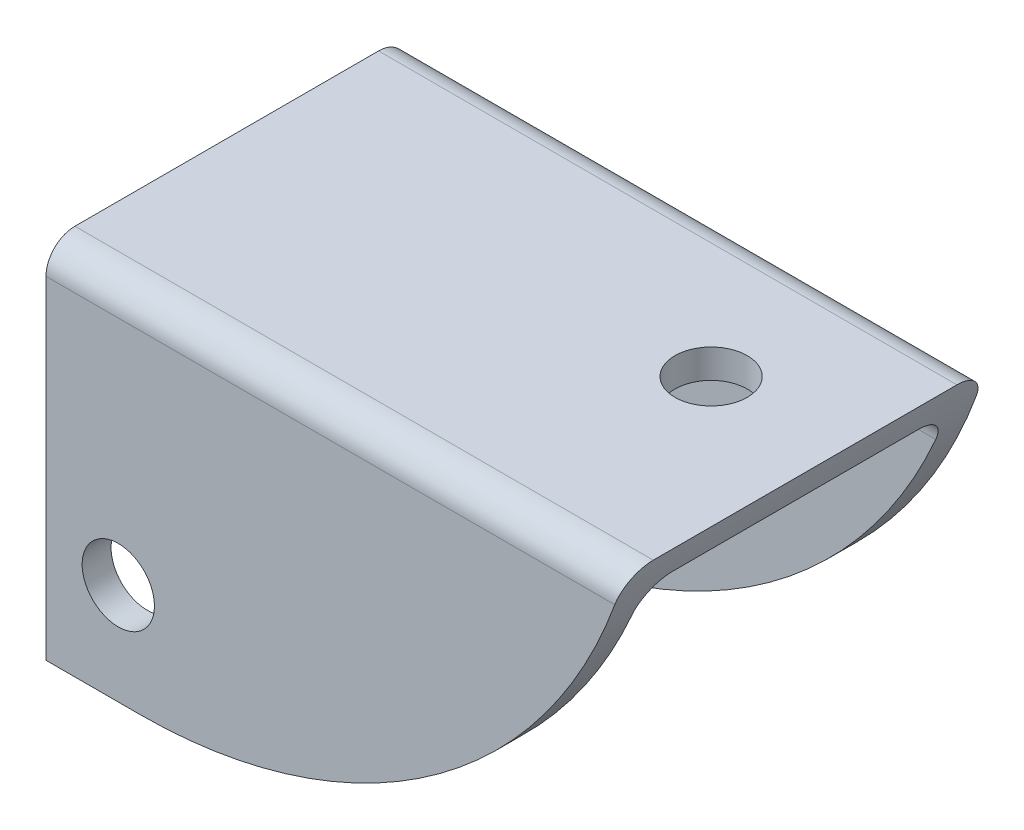
from build123d import *

# Parameters (mm, degrees)
EXTRUDE_1_DEPTH     = 40
CUT_EXTRUDE_1_DEPTH = 40
SKETCH_4_R          = 2.5
CUT_EXTRUDE_2_DEPTH = 54.38539126
SKETCH_5_R          = 2.5
CUT_EXTRUDE_3_DEPTH = 54.38539126
FILLET_1_R          = 2


with BuildPart() as part:
    # 草图1 → 凸台-拉伸1 (new body)
    with BuildSketch(Plane(origin=(0, 0, 0), x_dir=(0, 0, -1), z_dir=(1, 0, 0))):
        Polygon((0, 0), (0, 25), (25, 25), (25, 0), (23, 0), (23, 23), (2, 23), (2, 0), align=None)
    extrude(amount=EXTRUDE_1_DEPTH)

    # 草图3 → 切除-拉伸1 (cut)
    with BuildSketch(Plane.XY):
        with BuildLine():
            Line((40, 25), (40, 0))
            Line((40, 0), (6.458980338, 0))
            ThreePointArc((6.458980338, 0), (27.375481001, 6.937569599), (40, 25))
        make_face()
    extrude(amount=-CUT_EXTRUDE_1_DEPTH, mode=Mode.SUBTRACT)

    # 草图4 → 切除-拉伸2 (cut, through all)
    with BuildSketch(Plane(origin=(0, 25, 0), x_dir=(1, 0, 0), z_dir=(0, 1, 0))):
        with Locations(Location((31, 15, 0), (0, 0, 270))):
            Circle(SKETCH_4_R)
    extrude(amount=-CUT_EXTRUDE_2_DEPTH, mode=Mode.SUBTRACT)

    # 草图5 → 切除-拉伸3 (cut, through all)
    with BuildSketch(Plane.XY):
        with Locations((5, 7)):
            Circle(SKETCH_5_R)
    extrude(amount=-CUT_EXTRUDE_3_DEPTH, mode=Mode.SUBTRACT)

    # 圆角1
    fillet_1_edges = [part.edges().sort_by_distance(p)[0] for p in [
        (20, 25, 0),
        (20, 25, -25),
        (19.668772392, 23, -23),
        (19.668772392, 23, -2),
    ]]
    fillet(fillet_1_edges, radius=FILLET_1_R)


solid = part.part
